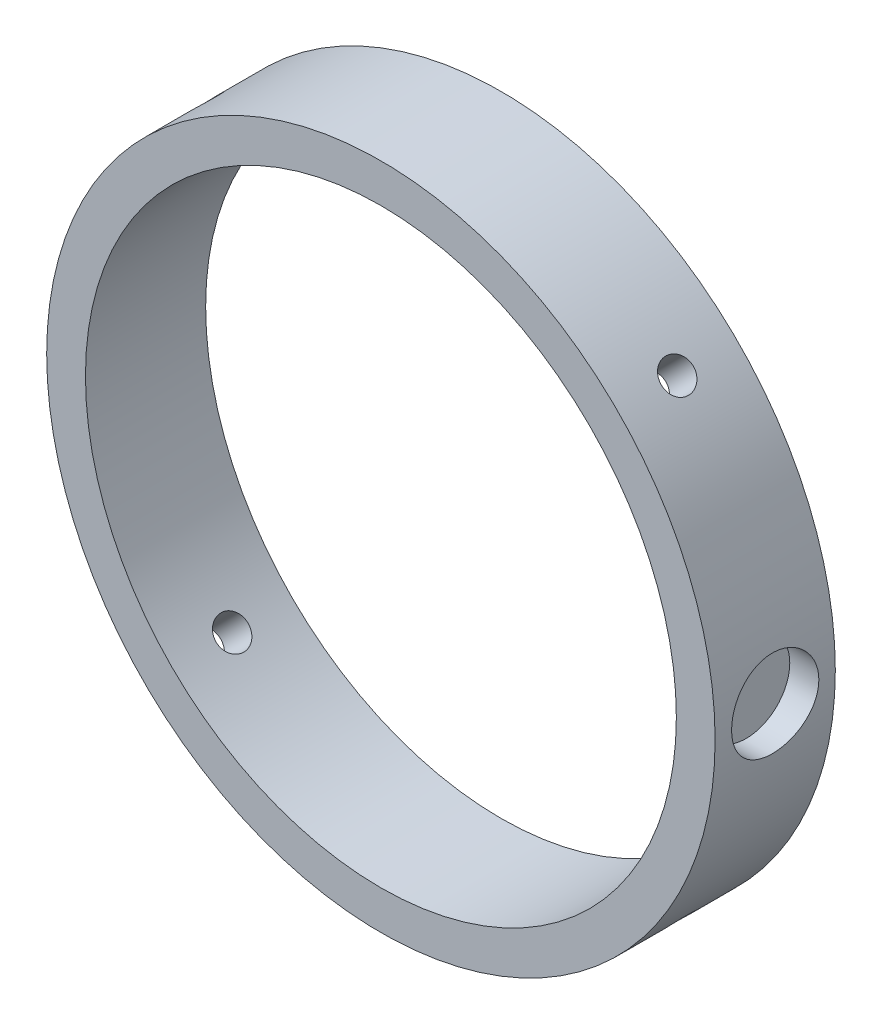
from build123d import *

# Parameters (mm, degrees)
ESBO_O2_R                                      = 86.2
ESBO_O2_R_2                                    = 76.2
RESSALTO_EXTRUS_O1_DEPTH                       = 31
FURO_ROSCADO_PARA_CONDU_TE_DE_M8X1_252_D       = 8.3
FURO_ROSCADO_PARA_CONDU_TE_DE_M8X1_252_DEPTH   = 86.2
FURO_ROSCADO_PARA_CONDU_TE_DE_M8X1_252_O_D     = 8.3
FURO_ROSCADO_PARA_CONDU_TE_DE_M8X1_252_O_DEPTH = 86.2
FURO_ROSCADO_PARA_CONDU_TE_DE_M8X1_2_2_D       = 8.3
FURO_ROSCADO_PARA_CONDU_TE_DE_M8X1_2_2_DEPTH   = 86.2
FURO_ROSCADO_PARA_CONDU_TE_DE_M8X1_2_3_D       = 8.3
FURO_ROSCADO_PARA_CONDU_TE_DE_M8X1_2_3_DEPTH   = 86.2
ESBO_O11_R                                     = 11.25
CORTE_EXTRUS_O1_DEPTH                          = 7.5


with BuildPart() as part:
    # Esboço2 → Ressalto-extrusão1 (new body)
    with BuildSketch(Plane.XY):
        Circle(ESBO_O2_R)
        Circle(ESBO_O2_R_2, mode=Mode.SUBTRACT)
    extrude(amount=RESSALTO_EXTRUS_O1_DEPTH)

    # Furo roscado para conduíte de M8x1.252
    with Locations(Plane(origin=(60.952604538, -60.952604538, 15.5), x_dir=(-0.707106781187, -0.707106781187, 0), z_dir=(0.707106781187, -0.707106781187, 0))):
        with Locations((0, 0)):
            Hole(FURO_ROSCADO_PARA_CONDU_TE_DE_M8X1_252_D / 2, depth=FURO_ROSCADO_PARA_CONDU_TE_DE_M8X1_252_DEPTH)

    # Furo roscado para conduíte de M8x1.252 o
    with Locations(Plane(origin=(-60.952604538, 60.952604538, 15.5), x_dir=(0.707106781187, 0.707106781187, 0), z_dir=(-0.707106781187, 0.707106781187, 0))):
        with Locations((0, 0)):
            Hole(FURO_ROSCADO_PARA_CONDU_TE_DE_M8X1_252_O_D / 2, depth=FURO_ROSCADO_PARA_CONDU_TE_DE_M8X1_252_O_DEPTH)

    # Furo roscado para condu_te de M8x1.2 2
    with Locations(Plane(origin=(60.952604538, 60.952604538, 15.5), x_dir=(0.707106781187, -0.707106781187, 0), z_dir=(0.707106781187, 0.707106781187, 0))):
        with Locations((0, 0)):
            Hole(FURO_ROSCADO_PARA_CONDU_TE_DE_M8X1_2_2_D / 2, depth=FURO_ROSCADO_PARA_CONDU_TE_DE_M8X1_2_2_DEPTH)

    # Furo roscado para condu_te de M8x1.2 3
    with Locations(Plane(origin=(-60.952604538, -60.952604538, 15.5), x_dir=(-0.707106781187, 0.707106781187, 0), z_dir=(-0.707106781187, -0.707106781187, 0))):
        with Locations((0, 0)):
            Hole(FURO_ROSCADO_PARA_CONDU_TE_DE_M8X1_2_3_D / 2, depth=FURO_ROSCADO_PARA_CONDU_TE_DE_M8X1_2_3_DEPTH)

    # Esboço11 → Corte-extrusão1 (cut)
    with BuildSketch(Plane(origin=(86.2, 0, 0), x_dir=(0, 0, -1), z_dir=(1, 0, 0))):
        with Locations((-15.5, 0)):
            Circle(ESBO_O11_R)
    corte_extrus_o1 = extrude(amount=-CORTE_EXTRUS_O1_DEPTH, mode=Mode.SUBTRACT)

    # Espelhar1: Corte-extrusão1 across plane
    add(corte_extrus_o1.mirror(Plane(origin=(0, 0, 0), x_dir=(0, 0, 1), z_dir=(1, 0, 0))), mode=Mode.SUBTRACT)


solid = part.part
